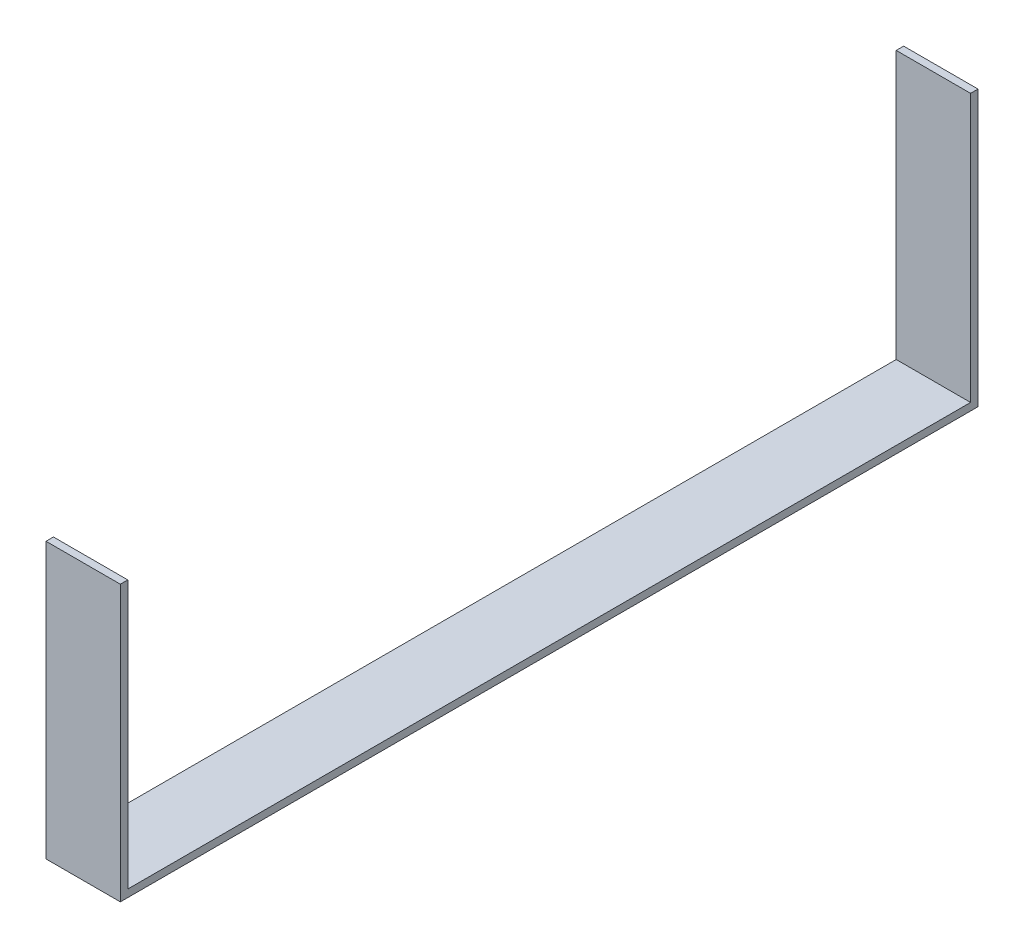
from build123d import *

# Parameters (mm, degrees)
BOSS_EXTRUDE1_DEPTH = 15


with BuildPart() as part:
    # Sketch1 → Boss-Extrude1 (new body)
    with BuildSketch(Plane(origin=(0, 0, 0), x_dir=(0, 0, -1), z_dir=(1, 0, 0))):
        Polygon((-85, 54), (-85, 0), (85, 0), (85, 54), (86.5, 54), (86.5, -1.5), (-86.5, -1.5), (-86.5, 54), align=None)
    extrude(amount=BOSS_EXTRUDE1_DEPTH)


solid = part.part
